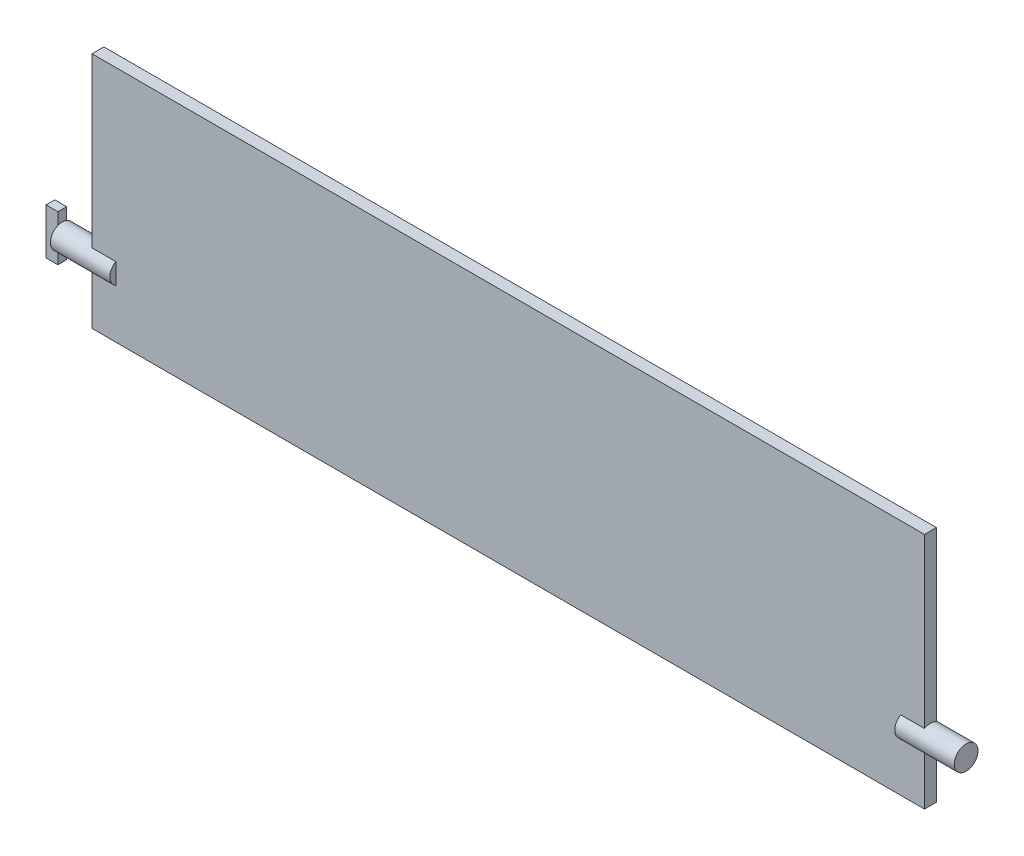
from build123d import *

# Parameters (mm, degrees)
SKETCH1_W           = 350
SKETCH1_H           = 50
BOSS_EXTRUDE1_DEPTH = 5
BOSS_EXTRUDE2_START = -10
SKETCH2_R           = 5
BOSS_EXTRUDE2_DEPTH = 25
SKETCH4_W           = 350
SKETCH4_H           = 5
BOSS_EXTRUDE4_DEPTH = 50
SKETCH5_W           = 3.668837662
SKETCH5_H           = 19.311798598
BOSS_EXTRUDE5_DEPTH = 5


with BuildPart() as part:
    # Sketch1 → Boss-Extrude1 (new body)
    with BuildSketch(Plane.XY):
        Rectangle(SKETCH1_W, SKETCH1_H)
    extrude(amount=BOSS_EXTRUDE1_DEPTH)

    # Sketch2 → Boss-Extrude2 (add)
    with BuildSketch(Plane.ZY.offset(175).offset(BOSS_EXTRUDE2_START)):
        with Locations((2.5, 0)):
            Circle(SKETCH2_R)
    boss_extrude2 = extrude(amount=BOSS_EXTRUDE2_DEPTH)

    # Mirror1: Boss-Extrude2 across plane
    add(boss_extrude2.mirror(Plane(origin=(0, 0, 0), x_dir=(0, 0, 1), z_dir=(1, 0, 0))))

    # Sketch4 → Boss-Extrude4 (add)
    with BuildSketch(Plane(origin=(0, 25, 0), x_dir=(1, 0, 0), z_dir=(0, 1, 0))):
        with Locations((0, -2.5)):
            Rectangle(SKETCH4_W, SKETCH4_H)
    extrude(amount=BOSS_EXTRUDE4_DEPTH)

    # Sketch5 → Boss-Extrude5 (add)
    with BuildSketch(Plane.ZY.offset(190)):
        with Locations((2.5, 0)):
            Rectangle(SKETCH5_W, SKETCH5_H)
    extrude(amount=BOSS_EXTRUDE5_DEPTH)


solid = part.part
